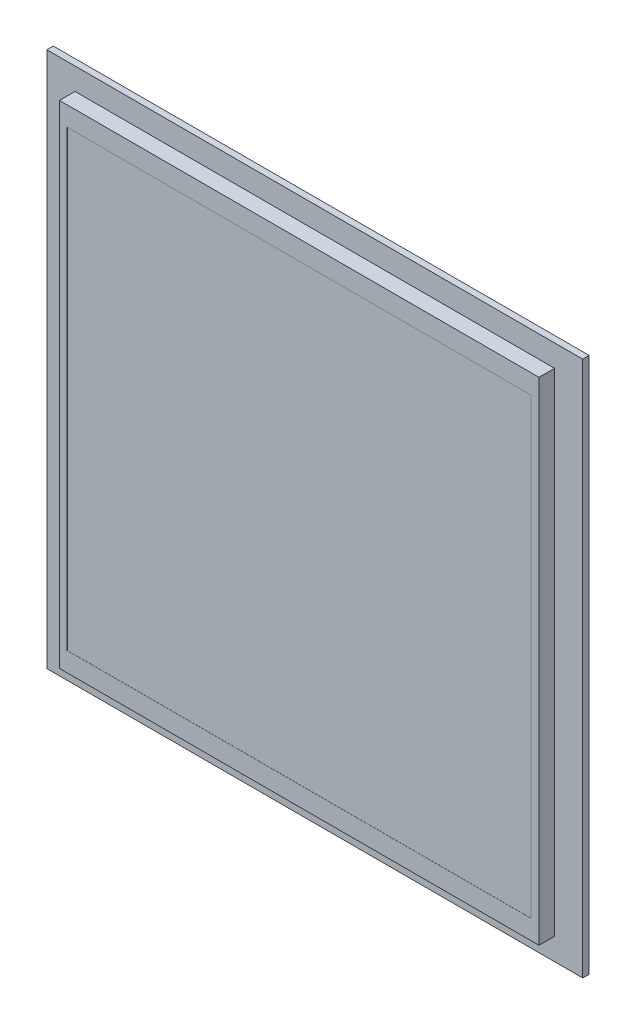
from build123d import *

# Parameters (mm, degrees)
SKETCH_1_W      = 83
SKETCH_1_H      = 83
EXTRUDE_2_DEPTH = 1
SKETCH_1_5_W    = 71.856
SKETCH_1_5_H    = 70.176
EXTRUDE_5_DEPTH = 3.4
SKETCH_1_6_W    = 74.26
SKETCH_1_6_H    = 76.18
SKETCH_1_6_W_2  = 71.856
SKETCH_1_6_H_2  = 70.176
EXTRUDE_6_DEPTH = 3.41


with BuildPart() as part:
    # Эскиз1 → Бобышка-Вытянуть2 (new body)
    with BuildSketch(Plane.XY):
        Rectangle(SKETCH_1_W, SKETCH_1_H)
    extrude(amount=EXTRUDE_2_DEPTH)

    # Эскиз1<5> → Бобышка-Вытянуть5 (add)
    with BuildSketch(Plane.XY):
        Rectangle(SKETCH_1_5_W, SKETCH_1_5_H)
    extrude(amount=EXTRUDE_5_DEPTH)

    # Эскиз1<6> → Бобышка-Вытянуть6 (add)
    with BuildSketch(Plane.XY):
        Rectangle(SKETCH_1_6_W, SKETCH_1_6_H)
        Rectangle(SKETCH_1_6_W_2, SKETCH_1_6_H_2, mode=Mode.SUBTRACT)
    extrude(amount=EXTRUDE_6_DEPTH)


solid = part.part
